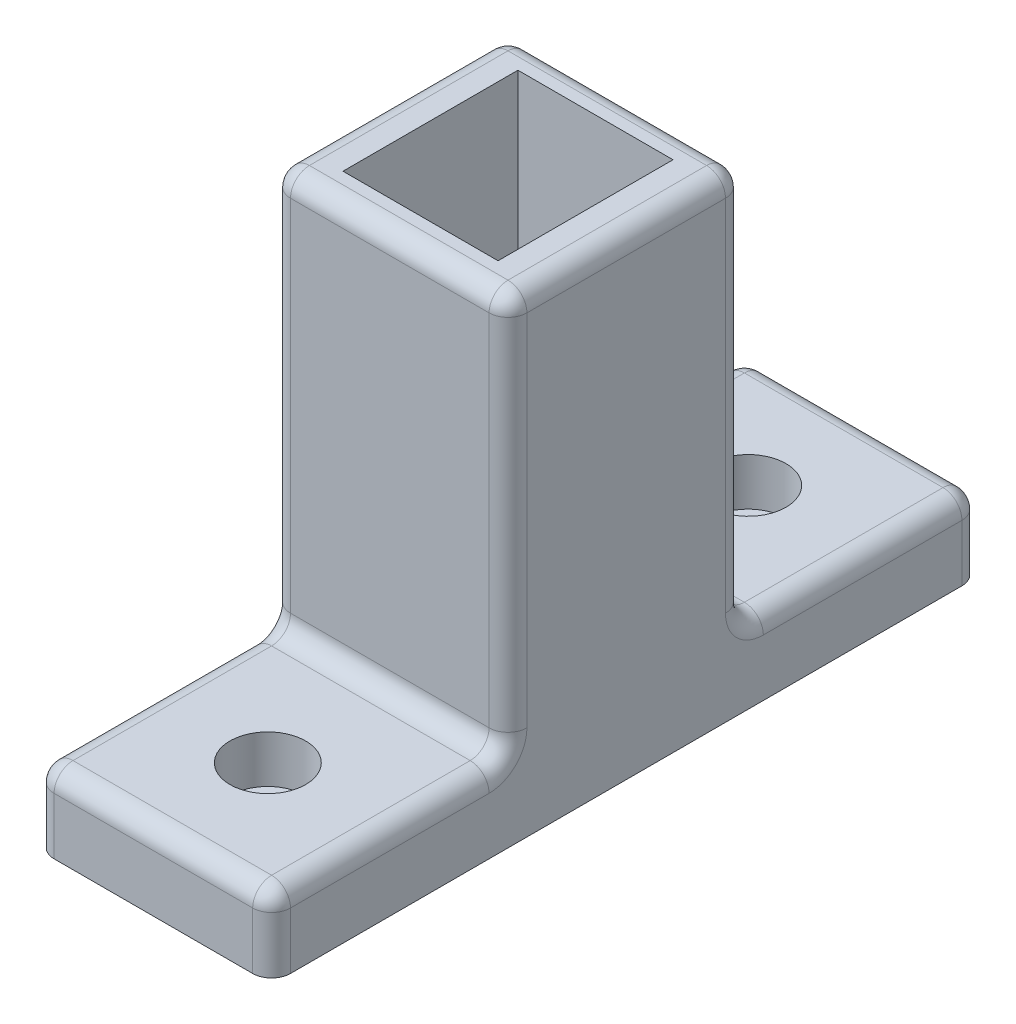
from build123d import *

# Parameters (mm, degrees)
SKETCH1_W               = 25
SKETCH1_H               = 25
SKETCH1_W_2             = 16.4
SKETCH1_H_2             = 18.5
BOSS_EXTRUDE1_DEPTH     = 50
SKETCH6_W               = 25
SKETCH6_H               = 75
BOSS_EXTRUDE3_DEPTH     = 8
FILLET2_R               = 2
SKETCH7_R               = 4
CUT_EXTRUDE1_DEPTH      = 5
CUT_EXTRUDE4_DEPTH      = 64.73774392
CUT_EXTRUDE4_DEPTH_BACK = 64.73774392
SKETCH8_R               = 2.38125


with BuildPart() as part:
    # Sketch1 → Boss-Extrude1 (new body)
    with BuildSketch(Plane(origin=(0, 0, 0), x_dir=(1, 0, 0), z_dir=(0, 1, 0))):
        Rectangle(SKETCH1_W, SKETCH1_H)
        Rectangle(SKETCH1_W_2, SKETCH1_H_2, mode=Mode.SUBTRACT)
    extrude(amount=BOSS_EXTRUDE1_DEPTH)

    # Sketch6 → Boss-Extrude3 (add)
    with BuildSketch(Plane(origin=(0, 0, 0), x_dir=(1, 0, 0), z_dir=(0, 1, 0))):
        Rectangle(SKETCH6_W, SKETCH6_H)
    extrude(amount=BOSS_EXTRUDE3_DEPTH)

    # Fillet2
    fillet2_edges = [part.edges().sort_by_distance(p)[0] for p in [
        (-12.5, 50, 0),
        (0, 50, 12.5),
        (12.5, 4, 37.5),
        (-12.5, 4, -37.5),
        (-12.5, 8, -25),
        (0, 8, -12.5),
        (12.5, 8, -25),
        (0, 8, -37.5),
        (12.5, 8, 25),
        (0, 8, 12.5),
        (-12.5, 8, 25),
        (0, 8, 37.5),
        (12.5, 4, -37.5),
        (-12.5, 4, 37.5),
        (12.5, 50, 0),
        (12.5, 29, 12.5),
        (-12.5, 29, 12.5),
        (-12.5, 29, -12.5),
        (12.5, 29, -12.5),
        (0, 50, -12.5),
    ]]
    fillet(fillet2_edges, radius=FILLET2_R)

    # Sketch7 → Cut-Extrude1 (cut)
    with BuildSketch(Plane(origin=(0, 8, 0), x_dir=(1, 0, 0), z_dir=(0, 1, 0))):
        with Locations(Location((0, 0, 0), (0, 0, 270))):
            Circle(SKETCH7_R)
        with Locations(Location((0, 25.4, 0), (0, 0, 270))):
            Circle(SKETCH7_R)
        with Locations(Location((0, -25.4, 0), (0, 0, 270))):
            Circle(SKETCH7_R)
    extrude(amount=-CUT_EXTRUDE1_DEPTH, mode=Mode.SUBTRACT)

    # Sketch8 → Cut-Extrude4 (cut, two sides: drawn at the far end of the back side and taken through both)
    with BuildSketch(Plane(origin=(0, 0, 0), x_dir=(1, 0, 0), z_dir=(0, 1, 0)).offset(-CUT_EXTRUDE4_DEPTH_BACK)):
        with Locations(Location((0, 0, 0), (0, 0, 270))):
            Circle(SKETCH8_R)
        with Locations(Location((0, 25.4, 0), (0, 0, 270))):
            Circle(SKETCH8_R)
        with Locations(Location((0, -25.4, 0), (0, 0, 270))):
            Circle(SKETCH8_R)
    extrude(amount=CUT_EXTRUDE4_DEPTH + CUT_EXTRUDE4_DEPTH_BACK, mode=Mode.SUBTRACT)


solid = part.part
